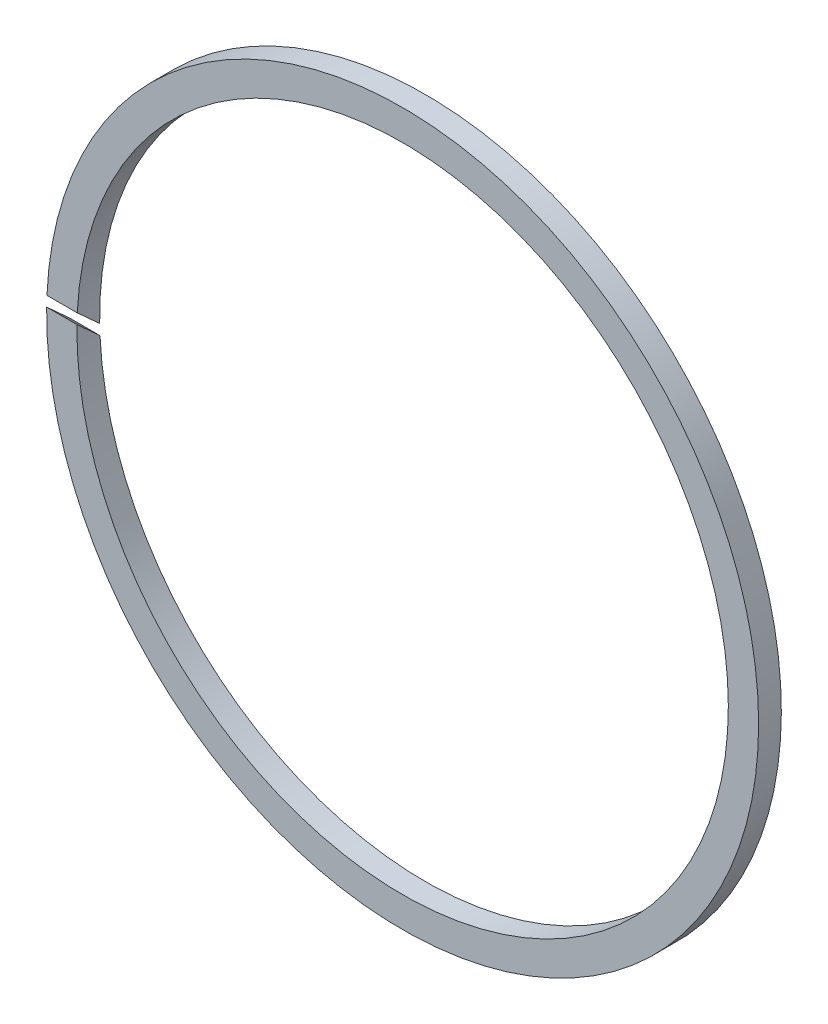
from build123d import *

# Parameters (mm, degrees)
SKETCH1_R           = 47
SKETCH1_R_2         = 43
BOSS_EXTRUDE1_DEPTH = 1.5
CUT_EXTRUDE1_DEPTH  = 67.484960705


with BuildPart() as part:
    # Sketch1 → Boss-Extrude1 (new, symmetric)
    with BuildSketch(Plane.XY):
        Circle(SKETCH1_R)
        Circle(SKETCH1_R_2, mode=Mode.SUBTRACT)
    extrude(amount=BOSS_EXTRUDE1_DEPTH, both=True)

    # Sketch2 → Cut-Extrude1 (cut, through all)
    with BuildSketch(Plane(origin=(0, 0, 0), x_dir=(0, 0, -1), z_dir=(1, 0, 0))):
        Polygon((-7.723456939, 6.371672693), (7.049357633, -7.110313422), (7.723456939, -6.371672693), (-7.049357633, 7.110313422), align=None)
    extrude(amount=-CUT_EXTRUDE1_DEPTH, mode=Mode.SUBTRACT)


solid = part.part
